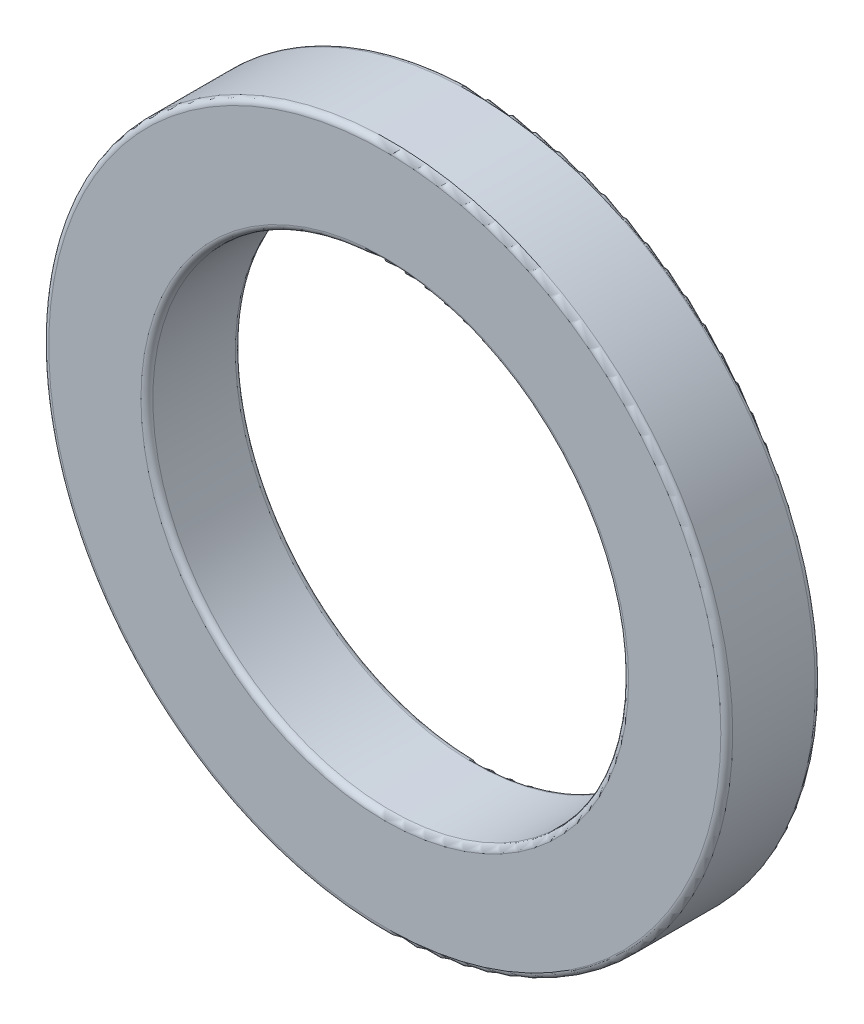
from build123d import *

# Parameters (mm, degrees)
SKETCH1_R           = 5.75
SKETCH1_R_2         = 4
BOSS_EXTRUDE1_DEPTH = 0.79375
FILLET1_R           = 0.1


with BuildPart() as part:
    # Sketch1 → Boss-Extrude1 (new, symmetric)
    with BuildSketch(Plane.XY):
        Circle(SKETCH1_R)
        Circle(SKETCH1_R_2, mode=Mode.SUBTRACT)
    extrude(amount=BOSS_EXTRUDE1_DEPTH, both=True)

    # Fillet1
    fillet1_edges = [part.edges().sort_by_distance(p)[0] for p in [
        (-5.75, 0, -0.79375),
        (-5.75, 0, 0.79375),
        (-4, 0, -0.79375),
        (-4, 0, 0.79375),
    ]]
    fillet(fillet1_edges, radius=FILLET1_R)


solid = part.part
